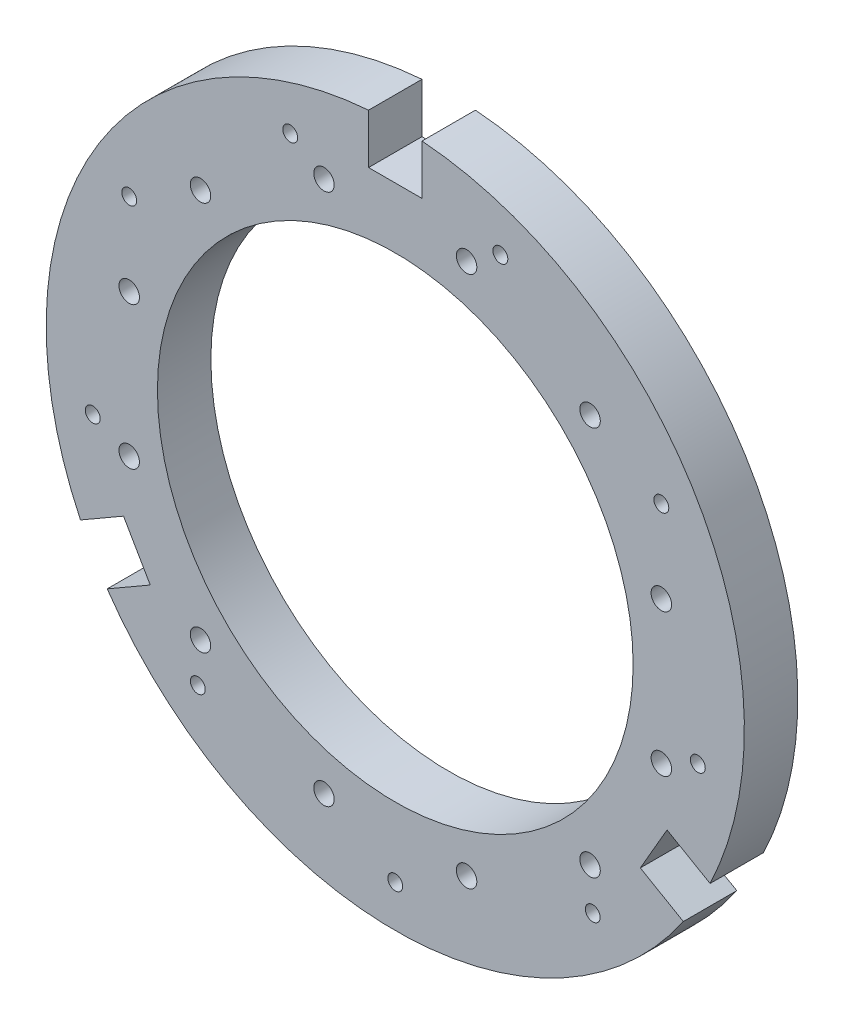
from build123d import *

# Parameters (mm, degrees)
ESQUISSE1_R        = 51.1
BOSS_EXTRU_1_DEPTH = 11.482
SKETCH2_R          = 1.6
CUT_EXTRUDE1_DEPTH = 107.685689406
CIRPATTERN1_COUNT  = 9
SKETCH3_R          = 2.2
CUT_EXTRUDE2_DEPTH = 25
CIRPATTERN2_COUNT  = 12


with BuildPart() as part:
    # Esquisse1 → Boss.-Extru.1 (new body)
    with BuildSketch(Plane.XY):
        with BuildLine():
            Line((52.641728383, -37.021851843), (61.890836376, -42.361826833))
            ThreePointArc((61.890836376, -42.361826833), (0, -75), (-61.890836376, -42.361826833))
            Line((-61.890836376, -42.361826833), (-52.641728383, -37.021851843))
            Line((-52.641728383, -37.021851843), (-58.382728383, -27.078148157))
            Line((-58.382728383, -27.078148157), (-67.631836376, -32.418123147))
            ThreePointArc((-67.631836376, -32.418123147), (-64.951905284, 37.5), (-5.741, 74.77994998))
            Line((-5.741, 74.77994998), (-5.741, 64.1))
            Line((-5.741, 64.1), (5.741, 64.1))
            Line((5.741, 64.1), (5.741, 74.77994998))
            ThreePointArc((5.741, 74.77994998), (64.951905284, 37.5), (67.631836376, -32.418123147))
            Line((67.631836376, -32.418123147), (58.382728383, -27.078148157))
            Line((58.382728383, -27.078148157), (52.641728383, -37.021851843))
        make_face()
        Circle(ESQUISSE1_R, mode=Mode.SUBTRACT)
    extrude(amount=BOSS_EXTRU_1_DEPTH)

    # Sketch2 → Cut-Extrude1 (cut, through all)
    with BuildSketch(Plane.XY.offset(11.482)):
        with Locations((22.573329459, 62.019712972)):
            Circle(SKETCH2_R)
    cut_extrude1 = extrude(amount=-CUT_EXTRUDE1_DEPTH, mode=Mode.SUBTRACT)

    # CirPattern1: Cut-Extrude1 ×9 about axis
    cirpattern1_axis = Axis((0, 0, 0), (0, 0, 1))
    for i in range(1, CIRPATTERN1_COUNT):
        add(cut_extrude1.rotate(cirpattern1_axis, i * 360 / CIRPATTERN1_COUNT), mode=Mode.SUBTRACT)

    # Sketch3 → Cut-Extrude2 (cut, symmetric)
    with BuildSketch(Plane.XY):
        with Locations((15.316911089, 57.1634904)):
            Circle(SKETCH3_R)
    cut_extrude2 = extrude(amount=CUT_EXTRUDE2_DEPTH, both=True, mode=Mode.SUBTRACT)

    # CirPattern2: Cut-Extrude2 ×12 about axis
    cirpattern2_axis = Axis((0, 0, 0), (0, 0, 1))
    for i in range(1, CIRPATTERN2_COUNT):
        add(cut_extrude2.rotate(cirpattern2_axis, i * 360 / CIRPATTERN2_COUNT), mode=Mode.SUBTRACT)


solid = part.part
